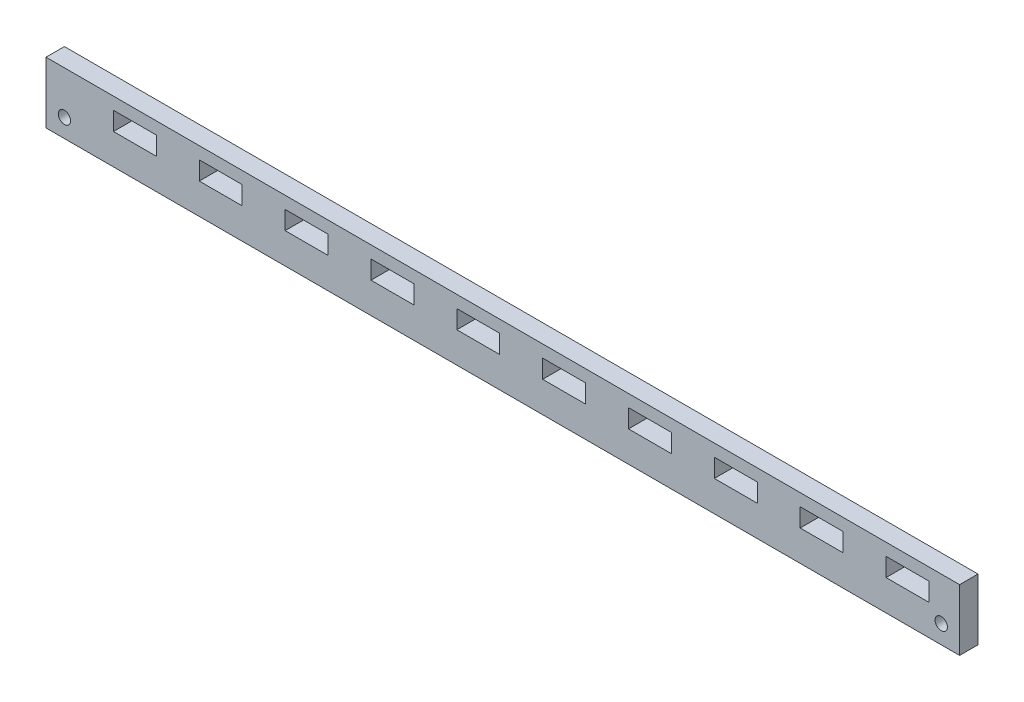
from build123d import *

# Parameters (mm, degrees)
ESQUISSE1_W             = 149
ESQUISSE1_H             = 10
BOSS_EXTRU_1_DEPTH      = 3
ESQUISSE2_R             = 1.005
ESQUISSE2_W             = 7
ESQUISSE2_H             = 3
ENL_V_MAT_EXTRU_1_DEPTH = 150.365323954


with BuildPart() as part:
    # Esquisse1 → Boss.-Extru.1 (new body)
    with BuildSketch(Plane.XY):
        with Locations((74.5, 5)):
            Rectangle(ESQUISSE1_W, ESQUISSE1_H)
    extrude(amount=BOSS_EXTRU_1_DEPTH)

    # Esquisse2 → Enlèv. mat.-Extru.1 (cut, through all)
    with BuildSketch(Plane(origin=(0, 0, 0), x_dir=(-1, 0, 0), z_dir=(0, 0, -1))):
        with Locations((-3, 3)):
            Circle(ESQUISSE2_R)
        with Locations((-146, 3)):
            Circle(ESQUISSE2_R)
        with Locations((-140.5, 6.5)):
            Rectangle(ESQUISSE2_W, ESQUISSE2_H)
        with Locations((-126.5, 6.5)):
            Rectangle(ESQUISSE2_W, ESQUISSE2_H)
        with Locations((-112.5, 6.5)):
            Rectangle(ESQUISSE2_W, ESQUISSE2_H)
        with Locations((-98.5, 6.5)):
            Rectangle(ESQUISSE2_W, ESQUISSE2_H)
        with Locations((-84.5, 6.5)):
            Rectangle(ESQUISSE2_W, ESQUISSE2_H)
        with Locations((-70.5, 6.5)):
            Rectangle(ESQUISSE2_W, ESQUISSE2_H)
        with Locations((-56.5, 6.5)):
            Rectangle(ESQUISSE2_W, ESQUISSE2_H)
        with Locations((-42.5, 6.5)):
            Rectangle(ESQUISSE2_W, ESQUISSE2_H)
        with Locations((-28.5, 6.5)):
            Rectangle(ESQUISSE2_W, ESQUISSE2_H)
        with Locations((-14.5, 6.5)):
            Rectangle(ESQUISSE2_W, ESQUISSE2_H)
    extrude(amount=-ENL_V_MAT_EXTRU_1_DEPTH, mode=Mode.SUBTRACT)


solid = part.part
